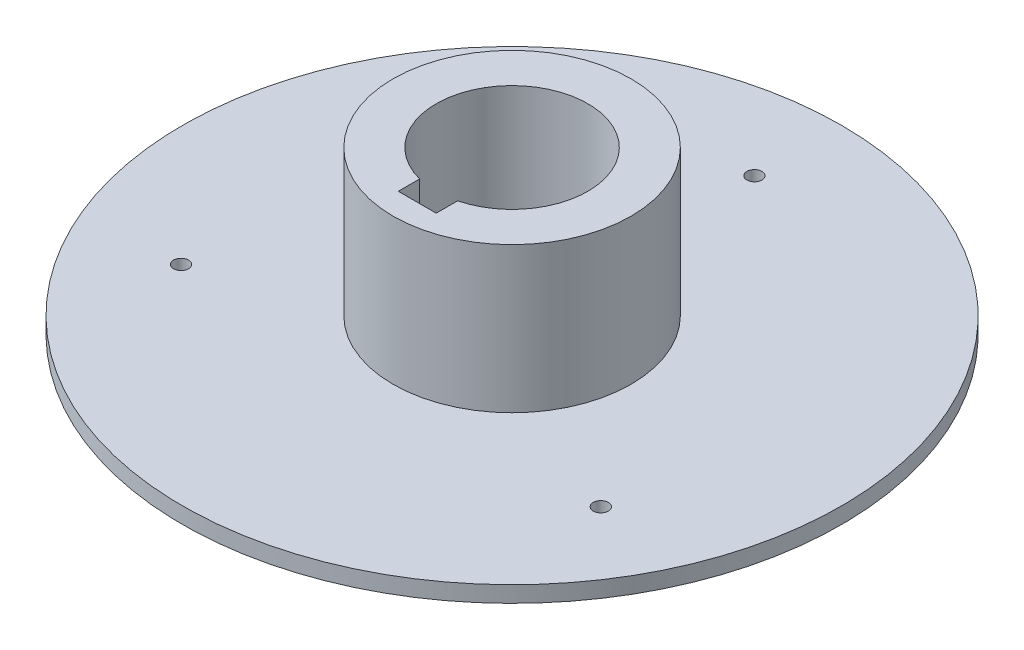
from build123d import *

# Parameters (mm, degrees)
F_1_8_0_125_DIAMETER_HOLE1_D = 3.175
CIRPATTERN2_COUNT            = 3
CIRPATTERN1_COUNT            = 3
CUT_EXTRUDE2_DEPTH           = 105.059003061


with BuildPart() as part:
    # Sketch1 → Revolve1 (revolve)
    with BuildSketch(Plane.XY, mode=Mode.PRIVATE) as revolve1_sk:
        Polygon((69.512129733, 0), (16, 0), (16, 34.123360884), (25.099562902, 34.123360884), (25.099562902, 3.412336088), (69.512129733, 3.412336088), align=None)
    revolve(revolve1_sk.sketch.rotate(Axis((0, 0, 0), (0, 1, 0)), 90), axis=Axis((0, 0, 0), (0, 1, 0)))

    # 1/8 (0.125) Diameter Hole1 (through all)
    with Locations(Plane(origin=(0, 3.412336088, -51.1125), x_dir=(0, 0, 1), z_dir=(0, 1, 0))):
        with Locations((0, 0)):
            f_1_8_0_125_diameter_hole1 = Hole(F_1_8_0_125_DIAMETER_HOLE1_D / 2)

    # CirPattern2: 1/8 (0.125) Diameter Hole1 ×3 about axis
    cirpattern2_axis = Axis((0, 0, 0), (0, 1, 0))
    for i in range(1, CIRPATTERN2_COUNT):
        add(f_1_8_0_125_diameter_hole1.rotate(cirpattern2_axis, i * 360 / CIRPATTERN2_COUNT), mode=Mode.SUBTRACT)

    # CirPattern1: 1/8 (0.125) Diameter Hole1 ×3 about axis
    cirpattern1_axis = Axis((0, 3.412336088, 0), (0, -1, 0))
    for i in range(1, CIRPATTERN1_COUNT):
        add(f_1_8_0_125_diameter_hole1.rotate(cirpattern1_axis, i * 360 / CIRPATTERN1_COUNT), mode=Mode.SUBTRACT)

    # Sketch4 → Cut-Extrude2 (cut, through all)
    with BuildSketch(Plane(origin=(0, 34.123360884, 0), x_dir=(1, 0, 0), z_dir=(0, 1, 0))):
        Polygon((0, -20), (4, -20), (4, -14.234250842), (-4, -14.234250842), (-4, -20), align=None)
    extrude(amount=-CUT_EXTRUDE2_DEPTH, mode=Mode.SUBTRACT)


solid = part.part
